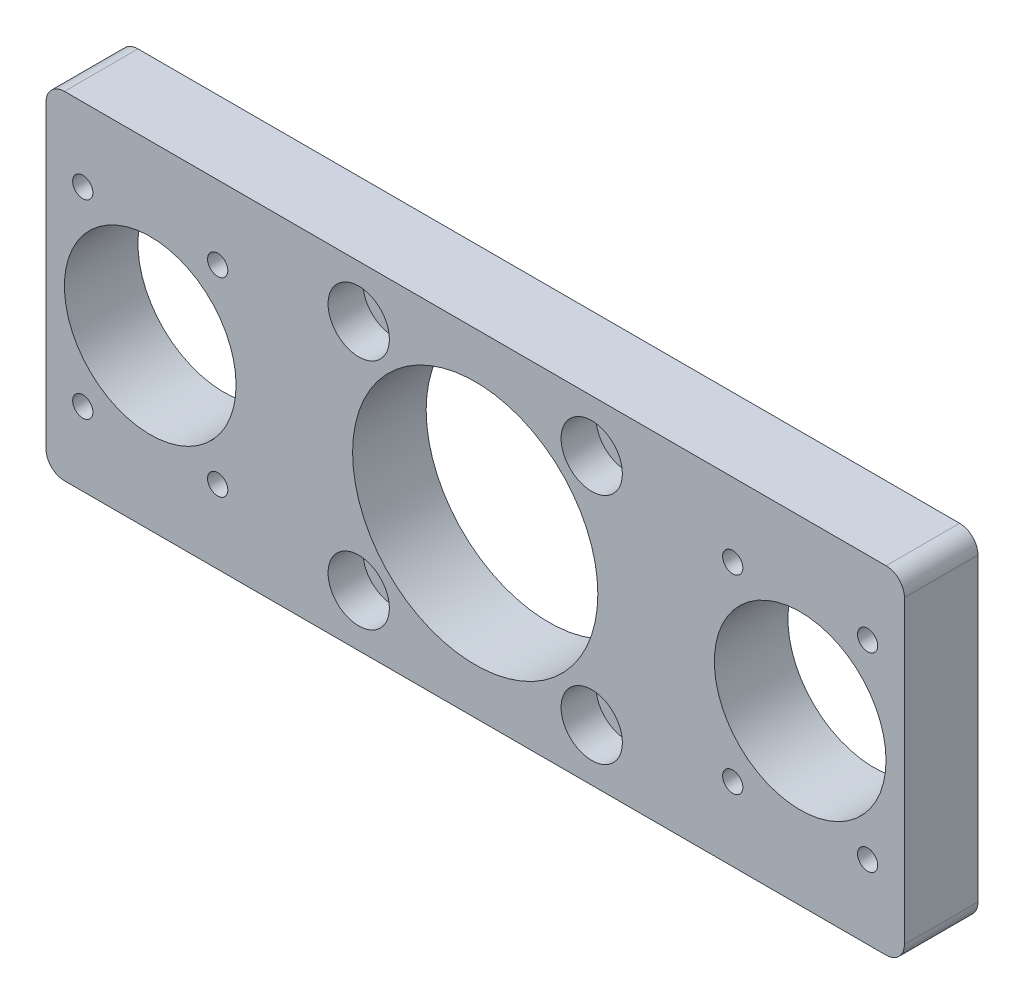
from build123d import *

# Parameters (mm, degrees)
SKETCH_1_W                = 140
SKETCH_1_H                = 55
EXTRUDE_1_DEPTH           = 12
SKETCH_2_R                = 20
SKETCH_2_R_2              = 14
CUT_EXTRUDE_1_DEPTH       = 77.159372371
FILLET_1_R                = 3
HOLE_WIZARD_M4_1_D        = 3.3
HOLE_WIZARD_1_D           = 5.5
HOLE_WIZARD_1_CBORE_D     = 10
HOLE_WIZARD_1_CBORE_DEPTH = 5.7


with BuildPart() as part:
    # 草图1 → 凸台-拉伸1 (new body)
    with BuildSketch(Plane.XY):
        Rectangle(SKETCH_1_W, SKETCH_1_H)
    extrude(amount=EXTRUDE_1_DEPTH)

    # 草图2 → 切除-拉伸1 (cut, through all)
    with BuildSketch(Plane.XY.offset(12)):
        Circle(SKETCH_2_R)
        with Locations((-53, 0)):
            Circle(SKETCH_2_R_2)
        with Locations((53, 0)):
            Circle(SKETCH_2_R_2)
    extrude(amount=-CUT_EXTRUDE_1_DEPTH, mode=Mode.SUBTRACT)

    # 圆角1
    fillet_1_edges = [part.edges().sort_by_distance(p)[0] for p in [
        (70, -27.5, 6),
        (-70, -27.5, 6),
        (-70, 27.5, 6),
        (70, 27.5, 6),
    ]]
    fillet(fillet_1_edges, radius=FILLET_1_R)

    # M4 螺纹孔1 (through all)
    with Locations(Plane.XY.offset(12)):
        with Locations((-64, 15.5), (-42, 15.5), (-42, -15.5), (-64, -15.5), (42, -15.5), (64, -15.5), (64, 15.5), (42, 15.5)):
            Hole(HOLE_WIZARD_M4_1_D / 2)

    # 打孔尺寸(%根据)内六角圆柱头螺钉的类型1 (through all)
    with Locations(Plane.XY.offset(12)):
        with Locations((-19, 19), (19, 19), (19, -19), (-19, -19)):
            CounterBoreHole(HOLE_WIZARD_1_D / 2, HOLE_WIZARD_1_CBORE_D / 2, HOLE_WIZARD_1_CBORE_DEPTH)


solid = part.part
